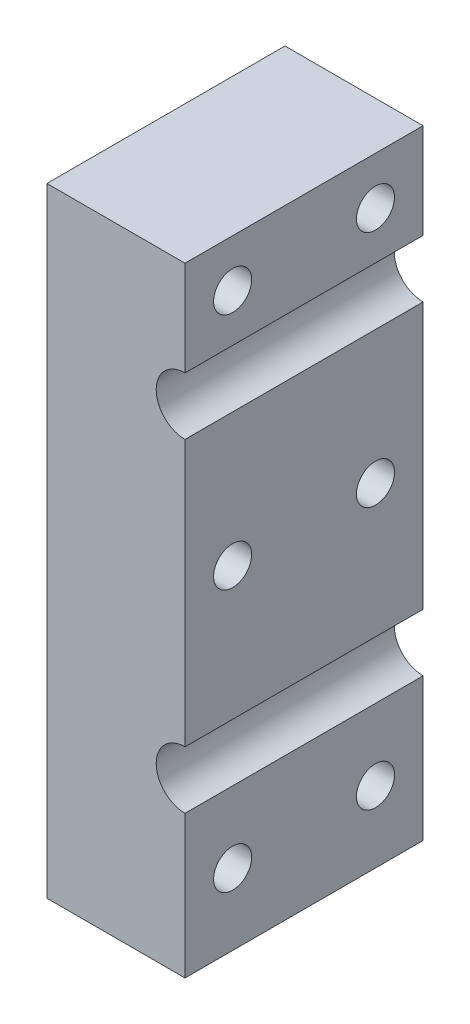
from build123d import *

# Parameters (mm, degrees)
SKETCH_1_W          = 29
SKETCH_1_H          = 65
EXTRUDE_1_DEPTH     = 25
SKETCH_2_R          = 3.025
SKETCH_2_R_2        = 3.005
CUT_EXTRUDE_3_DEPTH = 76.43871685
SKETCH_6_W          = 14.5
SKETCH_6_H          = 65
CUT_EXTRUDE_4_DEPTH = 76.43871685
SKETCH_7_R          = 2
CUT_EXTRUDE_5_DEPTH = 72.135434208
SKETCH_8_R          = 2
CUT_EXTRUDE_6_DEPTH = 72.135434208
SKETCH_9_R          = 2
CUT_EXTRUDE_7_DEPTH = 72.135434208


with BuildPart() as part:
    # 草图1 → 凸台-拉伸1 (new body)
    with BuildSketch(Plane.XY):
        with Locations((14.5, 32.5)):
            Rectangle(SKETCH_1_W, SKETCH_1_H)
    extrude(amount=EXTRUDE_1_DEPTH)

    # 草图2 → 切除-拉伸3 (cut, through all)
    # profile 1 of 2: a face of its own
    with BuildSketch(Plane.XY.offset(25)):
        with Locations((14.5, 52)):
            Circle(SKETCH_2_R)
        with Locations((14.5, 52)):
            Circle(SKETCH_2_R_2, mode=Mode.SUBTRACT)
    # profile 2 of 2: a face of its own
    with BuildSketch(Plane.XY.offset(25)):
        with Locations((14.5, 18)):
            Circle(SKETCH_2_R)
        with Locations((14.5, 18)):
            Circle(SKETCH_2_R_2, mode=Mode.SUBTRACT)
    extrude(amount=-CUT_EXTRUDE_3_DEPTH, mode=Mode.SUBTRACT)


with BuildPart() as cut_extrude_3_kept_piece:
    # of the separate pieces the step leaves, the one the design keeps (cut_extrude_3_pieces_kept)
    add(part.part.solids().sort_by_distance((0, 0, 0))[0])

    # 草图6 → 切除-拉伸4 (cut, through all)
    with BuildSketch(Plane.XY.offset(25)):
        with Locations((21.75, 32.5)):
            Rectangle(SKETCH_6_W, SKETCH_6_H)
    extrude(amount=-CUT_EXTRUDE_4_DEPTH, mode=Mode.SUBTRACT)

    # 草图7 → 切除-拉伸5 (cut, through all)
    with BuildSketch(Plane(origin=(14.5, 0, 0), x_dir=(0, 0, -1), z_dir=(1, 0, 0))):
        with Locations((-20, 60.0125)):
            Circle(SKETCH_7_R)
        with Locations((-5, 60.0125)):
            Circle(SKETCH_7_R)
    extrude(amount=-CUT_EXTRUDE_5_DEPTH, mode=Mode.SUBTRACT)

    # 草图8 → 切除-拉伸6 (cut, through all)
    with BuildSketch(Plane(origin=(14.5, 0, 0), x_dir=(0, 0, -1), z_dir=(1, 0, 0))):
        with Locations((-20, 35)):
            Circle(SKETCH_8_R)
        with Locations((-5, 35)):
            Circle(SKETCH_8_R)
    extrude(amount=-CUT_EXTRUDE_6_DEPTH, mode=Mode.SUBTRACT)

    # 草图9 → 切除-拉伸7 (cut, through all)
    with BuildSketch(Plane(origin=(14.5, 0, 0), x_dir=(0, 0, -1), z_dir=(1, 0, 0))):
        with Locations((-20, 7.4875)):
            Circle(SKETCH_9_R)
        with Locations((-5, 7.4875)):
            Circle(SKETCH_9_R)
    extrude(amount=-CUT_EXTRUDE_7_DEPTH, mode=Mode.SUBTRACT)


solid = cut_extrude_3_kept_piece.part
